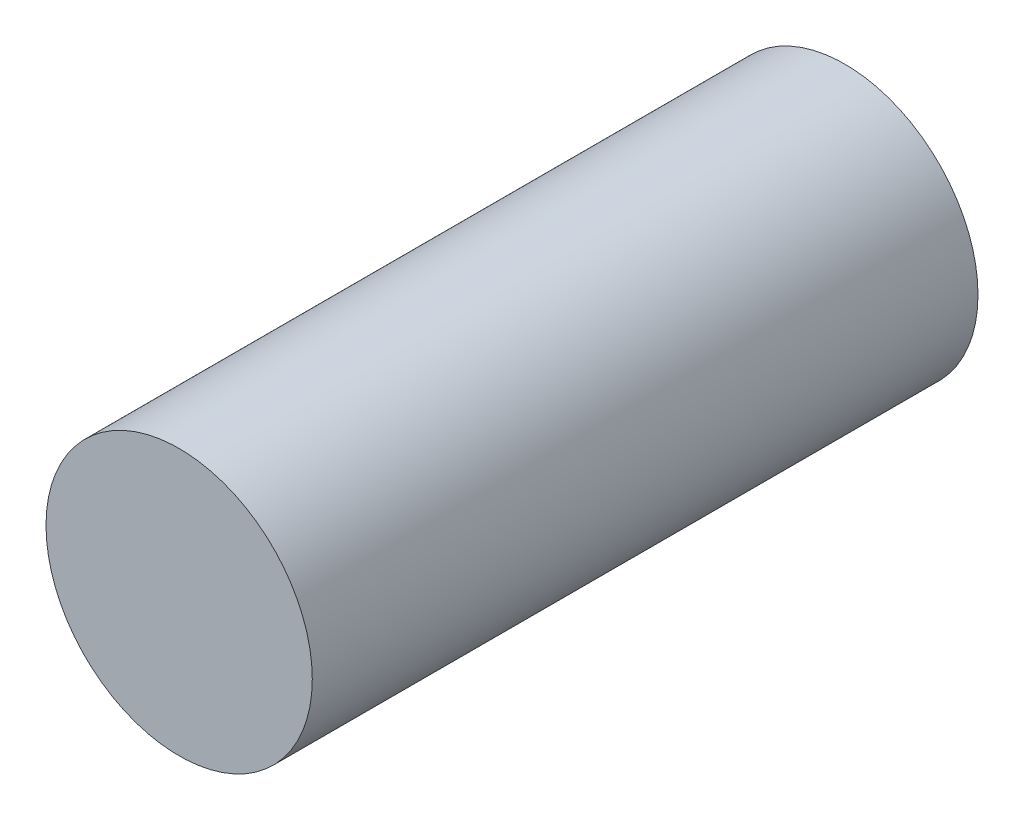
from build123d import *

# Parameters (mm, degrees)
SKETCH_1_R  = 3
SHANK_DEPTH = 15


with BuildPart() as part:
    # 草图1 → Shank (new body)
    with BuildSketch(Plane.XY):
        Circle(SKETCH_1_R)
    extrude(amount=SHANK_DEPTH)


solid = part.part
